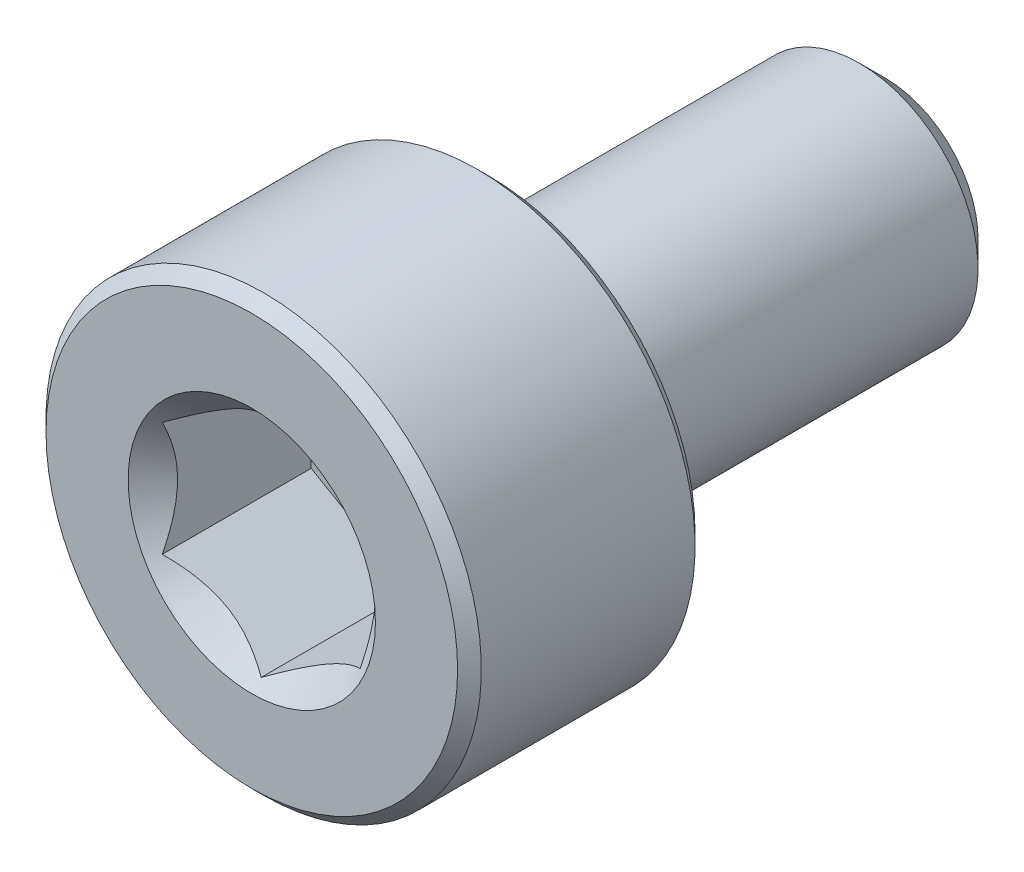
from build123d import *

# Parameters (mm, degrees)
CUT_EXTRUDE1_DEPTH = 2
SKETCH4_R          = 1.5625
CUT_EXTRUDE2_DEPTH = 1.5
CUT_EXTRUDE2_DRAFT = -45


with BuildPart() as part:
    # Sketch2 → Revolve1 (revolve)
    with BuildSketch(Plane(origin=(0, 0, 0), x_dir=(0, 0, -1), z_dir=(1, 0, 0))):
        with BuildLine():
            Line((-4, 0), (-4, 2.6))
            Line((-4, 2.6), (-3.85, 2.75))
            Line((-3.85, 2.75), (-1.15, 2.75))
            Line((-1.15, 2.75), (-1, 2.6))
            Line((-1, 2.6), (-1, 1.65))
            ThreePointArc((-1, 1.65), (-0.956066017, 1.543933983), (-0.85, 1.5))
            Line((-0.85, 1.5), (3.675240474, 1.5))
            Line((3.675240474, 1.5), (4, 1.175240474))
            Line((4, 1.175240474), (4, 0))
            Line((4, 0), (-4, 0))
        make_face()
    revolve(axis=Axis((0, 0, -4), (0, 0, 1)))

    # Sketch3 → Cut-Extrude1 (cut)
    with BuildSketch(Plane.XY.offset(4)):
        Polygon((1.25, -0.721687836), (1.25, 0.721687836), (0, 1.443375673), (-1.25, 0.721687836), (-1.25, -0.721687836), (0, -1.443375673), align=None)
    extrude(amount=-CUT_EXTRUDE1_DEPTH, mode=Mode.SUBTRACT)


with BuildPart() as cut_extrude2_tool:
    # Sketch4 → Cut-Extrude2 (with draft: the straight prism first)
    with BuildSketch(Plane.XY.offset(4)):
        Circle(SKETCH4_R)
    extrude(amount=-CUT_EXTRUDE2_DEPTH)
    # Cut-Extrude2: the draft: its side faces are tilted about the plane it starts from
    cut_extrude2_sides = [cut_extrude2_tool.faces().sort_by_distance(p)[0] for p in [
        (-1.5625, 0, 3.25),
    ]]
    draft(cut_extrude2_sides, Plane.XY.offset(4), CUT_EXTRUDE2_DRAFT)


with BuildPart() as part_1:
    add(part.part)

    # Cut-Extrude2: cut by cut_extrude2_tool
    add(cut_extrude2_tool.part, mode=Mode.SUBTRACT)


solid = part_1.part
